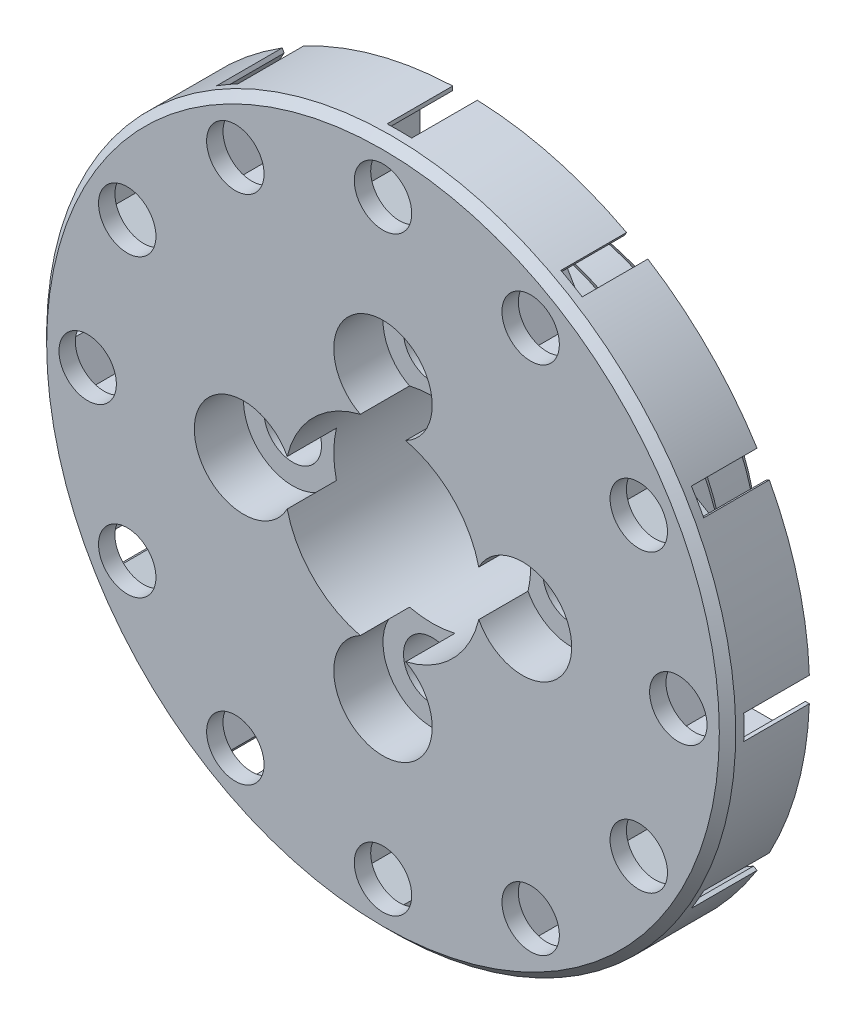
from build123d import *

# Parameters (mm, degrees)
SKIZZE4_R                        = 1.75
SCHNITT_LINEAR_AUSTRAGEN2_DEPTH  = 32.670175244
SCHNITT_LINEAR_AUSTRAGEN3_DEPTH  = 4
SKIZZE6_R                        = 1.75
SCHNITT_LINEAR_AUSTRAGEN6_DEPTH  = 32.670175244
FASE1_SIZE                       = 0.5
FASE2_SIZE                       = 0.5
SKIZZE8_W                        = 1.5
SKIZZE8_H                        = 2
SKIZZE8_W_2                      = 2
SKIZZE8_H_2                      = 1.5
SCHNITT_LINEAR_AUSTRAGEN8_DEPTH  = 4
SKIZZE9_R                        = 6
SCHNITT_LINEAR_AUSTRAGEN9_DEPTH  = 32.670175244
SKIZZE11_R                       = 3
SCHNITT_LINEAR_AUSTRAGEN10_DEPTH = 3


with BuildPart() as part:
    # Skizze1 → Rotation1 (revolve)
    with BuildSketch(Plane(origin=(0, 0, 0), x_dir=(0, 0, -1), z_dir=(1, 0, 0)), mode=Mode.PRIVATE) as rotation1_sk:
        Polygon((0, 0), (0, 21), (5, 21), (5, 14), (7.5, 14), (7.5, 12.35), (11, 12.35), (11, 0), align=None)
    revolve(rotation1_sk.sketch.rotate(Axis((0, 0, 0), (0, 0, -1)), 180), axis=Axis((0, 0, 0), (0, 0, -1)))

    # Skizze4 → Schnitt-Linear austragen2 (cut, through all)
    with BuildSketch(Plane.XY):
        with Locations((0, 18)):
            Circle(SKIZZE4_R)
        with Locations((9, 15.588457268)):
            Circle(SKIZZE4_R)
        with Locations((15.588457268, 9)):
            Circle(SKIZZE4_R)
        with Locations((18, 0)):
            Circle(SKIZZE4_R)
        with Locations((15.588457268, -9)):
            Circle(SKIZZE4_R)
        with Locations((9, -15.588457268)):
            Circle(SKIZZE4_R)
        with Locations((0, -18)):
            Circle(SKIZZE4_R)
        with Locations((-9, -15.588457268)):
            Circle(SKIZZE4_R)
        with Locations((-15.588457268, -9)):
            Circle(SKIZZE4_R)
        with Locations((-18, 0)):
            Circle(SKIZZE4_R)
        with Locations((-15.588457268, 9)):
            Circle(SKIZZE4_R)
        with Locations((-9, 15.588457268)):
            Circle(SKIZZE4_R)
    extrude(amount=-SCHNITT_LINEAR_AUSTRAGEN2_DEPTH, mode=Mode.SUBTRACT)

    # Skizze5 → Schnitt-Linear austragen3 (cut)
    with BuildSketch(Plane(origin=(0, 0, -5), x_dir=(-1, 0, 0), z_dir=(0, 0, -1))):
        Polygon((7.41228676, 12.838457268), (10.58771324, 12.838457268), (12.175426481, 15.588457268), (10.58771324, 18.338457268), (7.41228676, 18.338457268), (5.824573519, 15.588457268), align=None)
        Polygon((0, 14.824573519), (2.75, 16.41228676), (2.75, 19.58771324), (0, 21.175426481), (-2.75, 19.58771324), (-2.75, 16.41228676), align=None)
        Polygon((12.838457268, 7.41228676), (15.588457268, 5.824573519), (18.338457268, 7.41228676), (18.338457268, 10.58771324), (15.588457268, 12.175426481), (12.838457268, 10.58771324), align=None)
        Polygon((14.824573519, 0), (16.41228676, -2.75), (19.58771324, -2.75), (21.175426481, 0), (19.58771324, 2.75), (16.41228676, 2.75), align=None)
        Polygon((12.838457268, -7.41228676), (12.838457268, -10.58771324), (15.588457268, -12.175426481), (18.338457268, -10.58771324), (18.338457268, -7.41228676), (15.588457268, -5.824573519), align=None)
        Polygon((7.41228676, -12.838457268), (5.824573519, -15.588457268), (7.41228676, -18.338457268), (10.58771324, -18.338457268), (12.175426481, -15.588457268), (10.58771324, -12.838457268), align=None)
        Polygon((0, -14.824573519), (-2.75, -16.41228676), (-2.75, -19.58771324), (0, -21.175426481), (2.75, -19.58771324), (2.75, -16.41228676), align=None)
        Polygon((-7.41228676, -12.838457268), (-10.58771324, -12.838457268), (-12.175426481, -15.588457268), (-10.58771324, -18.338457268), (-7.41228676, -18.338457268), (-5.824573519, -15.588457268), align=None)
        Polygon((-12.838457268, -7.41228676), (-15.588457268, -5.824573519), (-18.338457268, -7.41228676), (-18.338457268, -10.58771324), (-15.588457268, -12.175426481), (-12.838457268, -10.58771324), align=None)
        Polygon((-14.824573519, 0), (-16.41228676, 2.75), (-19.58771324, 2.75), (-21.175426481, 0), (-19.58771324, -2.75), (-16.41228676, -2.75), align=None)
        Polygon((-12.838457268, 7.41228676), (-12.838457268, 10.58771324), (-15.588457268, 12.175426481), (-18.338457268, 10.58771324), (-18.338457268, 7.41228676), (-15.588457268, 5.824573519), align=None)
        Polygon((-7.41228676, 12.838457268), (-5.824573519, 15.588457268), (-7.41228676, 18.338457268), (-10.58771324, 18.338457268), (-12.175426481, 15.588457268), (-10.58771324, 12.838457268), align=None)
    extrude(amount=-SCHNITT_LINEAR_AUSTRAGEN3_DEPTH, mode=Mode.SUBTRACT)

    # Skizze6 → Schnitt-Linear austragen6 (cut, through all)
    with BuildSketch(Plane.XY):
        with Locations((0, 8.5)):
            Circle(SKIZZE6_R)
        with Locations((8.5, 0)):
            Circle(SKIZZE6_R)
        with Locations((0, -8.5)):
            Circle(SKIZZE6_R)
        with Locations((-8.5, 0)):
            Circle(SKIZZE6_R)
    extrude(amount=-SCHNITT_LINEAR_AUSTRAGEN6_DEPTH, mode=Mode.SUBTRACT)

    # Fase1
    fase1_edges = [part.edges().sort_by_distance(p)[0] for p in [
        (0, 12.35, -11),
        (0, 14, -7.5),
        (0, 14, -5),
    ]]
    chamfer(fase1_edges, length=FASE1_SIZE)

    # Fase2
    fase2_edges = [part.edges().sort_by_distance(p)[0] for p in [
        (0, 21, 0),
    ]]
    chamfer(fase2_edges, length=FASE2_SIZE)

    # Skizze8 → Schnitt-Linear austragen8 (cut)
    with BuildSketch(Plane(origin=(0, 0, -5), x_dir=(-1, 0, 0), z_dir=(0, 0, -1))):
        with Locations((0, 21)):
            Rectangle(SKIZZE8_W, SKIZZE8_H)
        Polygon((10.649519053, 16.945508076), (9.350480947, 17.695508076), (10.350480947, 19.427558883), (11.649519053, 18.677558883), align=None)
        Polygon((17.695508076, 9.350480947), (16.945508076, 10.649519053), (18.677558883, 11.649519053), (19.427558883, 10.350480947), align=None)
        with Locations((21, 0)):
            Rectangle(SKIZZE8_W_2, SKIZZE8_H_2)
        Polygon((16.945508076, -10.649519053), (17.695508076, -9.350480947), (19.427558883, -10.350480947), (18.677558883, -11.649519053), align=None)
        Polygon((9.350480947, -17.695508076), (10.649519053, -16.945508076), (11.649519053, -18.677558883), (10.350480947, -19.427558883), align=None)
        with Locations((0, -21)):
            Rectangle(SKIZZE8_W, SKIZZE8_H)
        Polygon((-10.649519053, -16.945508076), (-9.350480947, -17.695508076), (-10.350480947, -19.427558883), (-11.649519053, -18.677558883), align=None)
        Polygon((-17.695508076, -9.350480947), (-16.945508076, -10.649519053), (-18.677558883, -11.649519053), (-19.427558883, -10.350480947), align=None)
        with Locations((-21, 0)):
            Rectangle(SKIZZE8_W_2, SKIZZE8_H_2)
        Polygon((-16.945508076, 10.649519053), (-17.695508076, 9.350480947), (-19.427558883, 10.350480947), (-18.677558883, 11.649519053), align=None)
        Polygon((-9.350480947, 17.695508076), (-10.649519053, 16.945508076), (-11.649519053, 18.677558883), (-10.350480947, 19.427558883), align=None)
    extrude(amount=-SCHNITT_LINEAR_AUSTRAGEN8_DEPTH, mode=Mode.SUBTRACT)

    # Skizze9 → Schnitt-Linear austragen9 (cut, through all)
    with BuildSketch(Plane.XY):
        Circle(SKIZZE9_R)
    extrude(amount=-SCHNITT_LINEAR_AUSTRAGEN9_DEPTH, mode=Mode.SUBTRACT)

    # Skizze11 → Schnitt-Linear austragen10 (cut)
    with BuildSketch(Plane.XY):
        with Locations((0, 8.5)):
            Circle(SKIZZE11_R)
        with Locations((8.5, 0)):
            Circle(SKIZZE11_R)
        with Locations((0, -8.5)):
            Circle(SKIZZE11_R)
        with Locations((-8.5, 0)):
            Circle(SKIZZE11_R)
    extrude(amount=-SCHNITT_LINEAR_AUSTRAGEN10_DEPTH, mode=Mode.SUBTRACT)


solid = part.part
